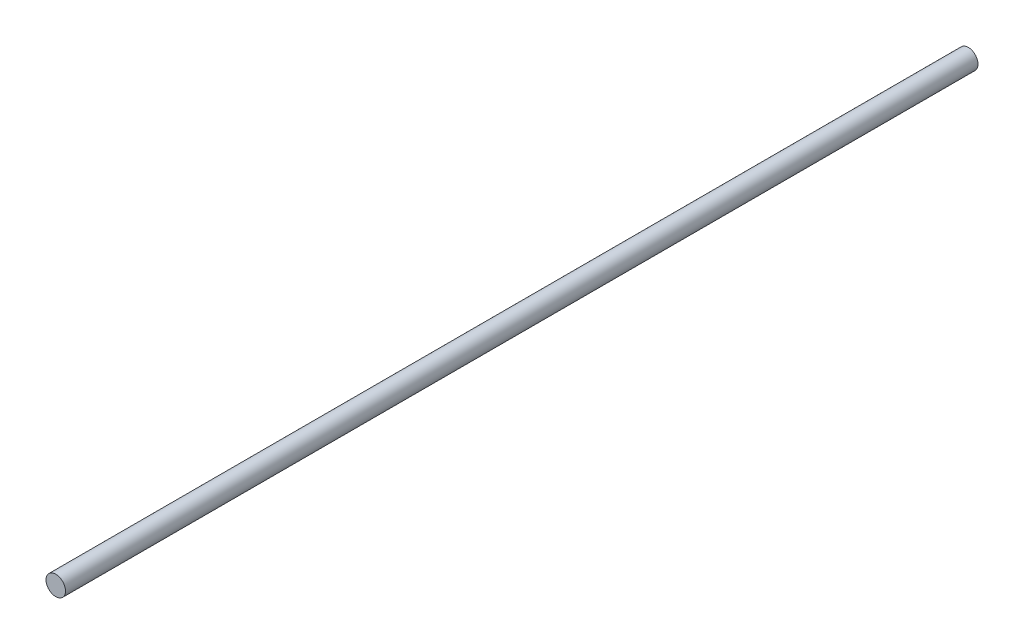
from build123d import *

# Parameters (mm, degrees)
SKETCH1_R           = 4
BOSS_EXTRUDE1_DEPTH = 374.65


with BuildPart() as part:
    # Sketch1 → Boss-Extrude1 (new body)
    with BuildSketch(Plane.XY):
        with Locations(Location((0, 0, 0), (0, 0, 180))):
            Circle(SKETCH1_R)
    extrude(amount=BOSS_EXTRUDE1_DEPTH)


solid = part.part
